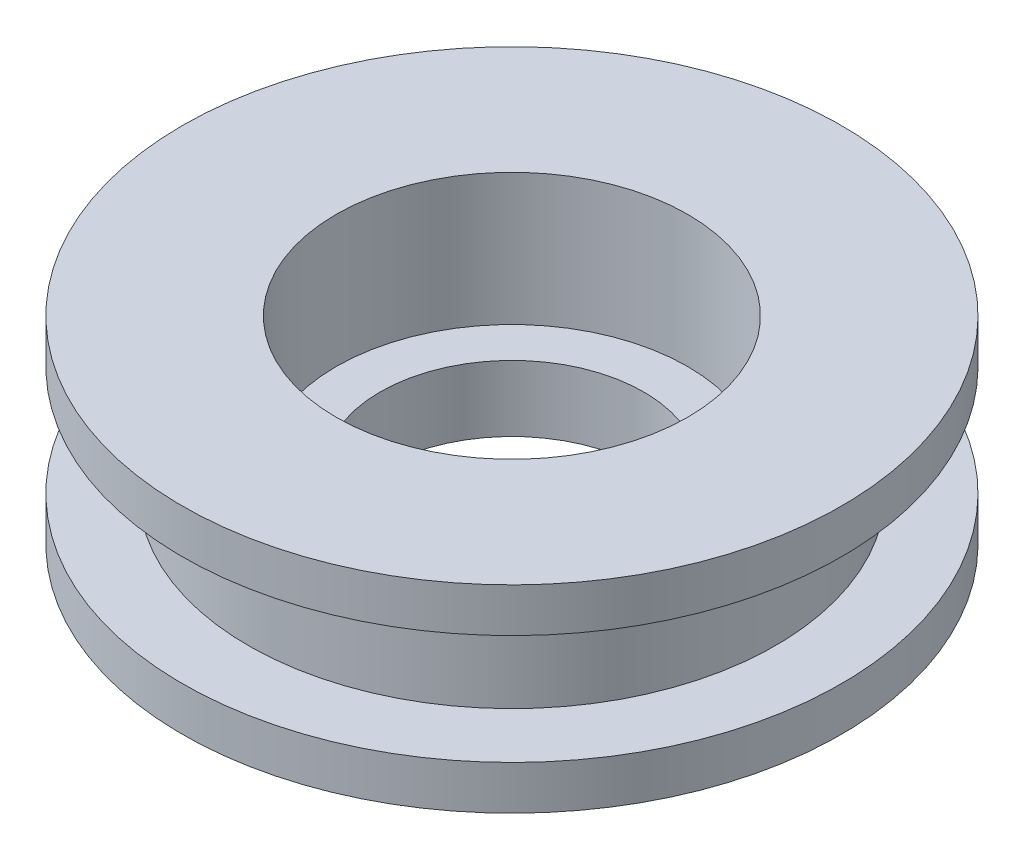
from build123d import *


with BuildPart() as part:
    # Sketch1 → Revolve1 (revolve)
    with BuildSketch(Plane.XY, mode=Mode.PRIVATE) as revolve1_sk:
        Polygon((4, 2.25), (4, -0.75), (3, -0.75), (3, -2.25), (7.5, -2.25), (7.5, -1.25), (6, -1.25), (6, 1.25), (7.5, 1.25), (7.5, 2.25), align=None)
    revolve(revolve1_sk.sketch.rotate(Axis((0, 6.620558795, 0), (0, -1, 0)), 180), axis=Axis((0, 6.620558795, 0), (0, -1, 0)))


solid = part.part
